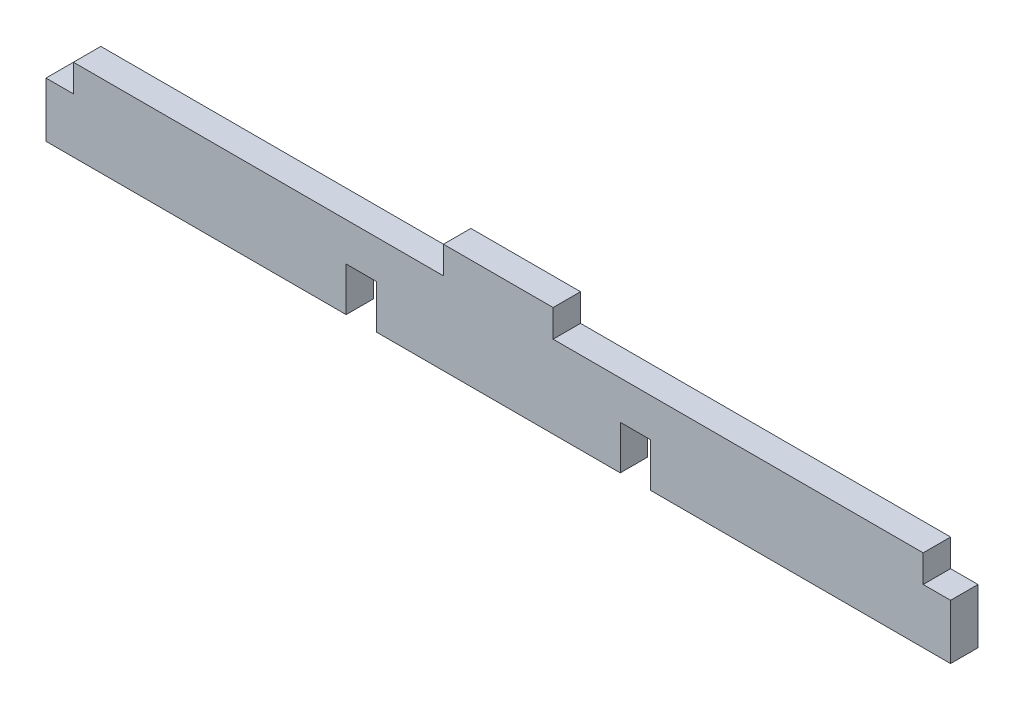
from build123d import *

# Parameters (mm, degrees)
BOSS_EXTRUDE1_DEPTH = 2.5


with BuildPart() as part:
    # Sketch2 → Boss-Extrude1 (new, symmetric)
    with BuildSketch(Plane.XY):
        Polygon((443.795656842, -203.645557825), (443.795656842, -195.645557825), (438.295656842, -195.645557825), (438.295656842, -203.645557825), (393.795656842, -203.645557825), (393.795656842, -195.645557825), (388.295656842, -195.645557825), (388.295656842, -203.645557825), (333.545659386, -203.645557825), (333.545659386, -193.645557825), (338.545659386, -193.645557825), (338.545659386, -188.645557825), (406.045659386, -188.645557825), (406.045659386, -183.645557825), (426.045659386, -183.645557825), (426.045659386, -188.645557825), (493.545659386, -188.645557825), (493.545659386, -193.645557825), (498.545659386, -193.645557825), (498.545659386, -203.645557825), align=None)
    extrude(amount=BOSS_EXTRUDE1_DEPTH, both=True)


solid = part.part
